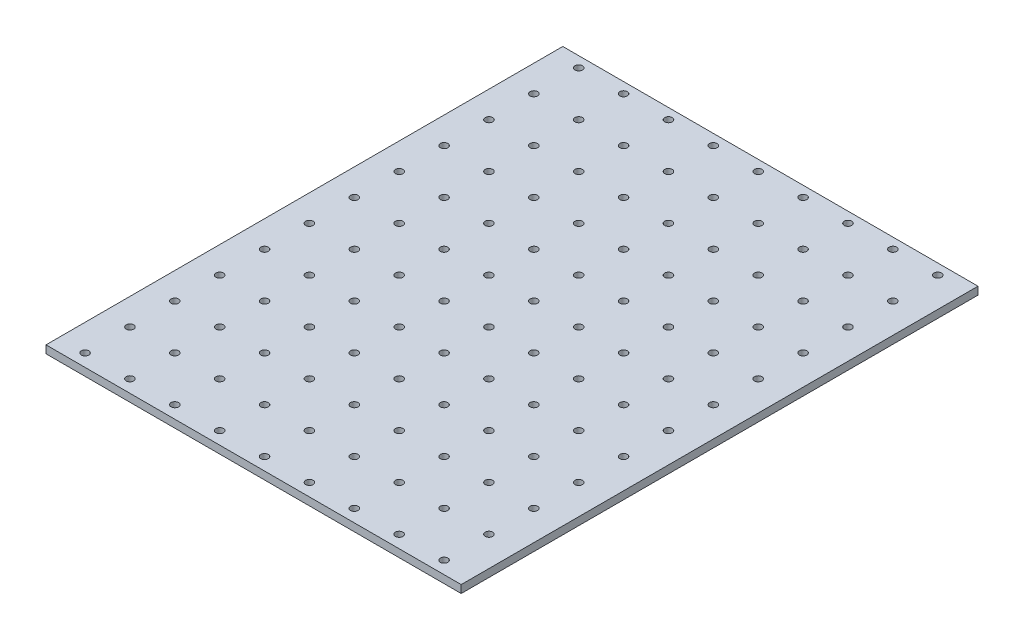
from build123d import *

# Parameters (mm, degrees)
SKETCH1_W            = 470
SKETCH1_H            = 585
BOSS_EXTRUDE1_DEPTH  = 8.8
SKETCH2_R            = 4.25
CUT_EXTRUDE1_DEPTH   = 8.8
LPATTERN1_COUNT      = 12
LPATTERN1_PITCH      = 50.8
LPATTERN1_COUNT_DIR2 = 9
LPATTERN1_PITCH_DIR2 = 50.8


with BuildPart() as part:
    # Sketch1 → Boss-Extrude1 (new body)
    with BuildSketch(Plane(origin=(0, 0, 0), x_dir=(1, 0, 0), z_dir=(0, 1, 0))):
        Rectangle(SKETCH1_W, SKETCH1_H)
    extrude(amount=BOSS_EXTRUDE1_DEPTH)

    # Sketch2 → Cut-Extrude1 (cut)
    with BuildSketch(Plane(origin=(0, 8.8, 0), x_dir=(1, 0, 0), z_dir=(0, 1, 0))):
        with Locations(Location((-205, 280.5, 0), (0, 0, 270))):
            Circle(SKETCH2_R)
    cut_extrude1 = extrude(amount=-CUT_EXTRUDE1_DEPTH, mode=Mode.SUBTRACT)

    # LPattern1: Cut-Extrude1 12 × 9
    with Locations(*[(j * LPATTERN1_PITCH_DIR2, 0, i * LPATTERN1_PITCH) for i in range(LPATTERN1_COUNT) for j in range(LPATTERN1_COUNT_DIR2) if (i, j) != (0, 0)]):
        add(cut_extrude1, mode=Mode.SUBTRACT)


solid = part.part
